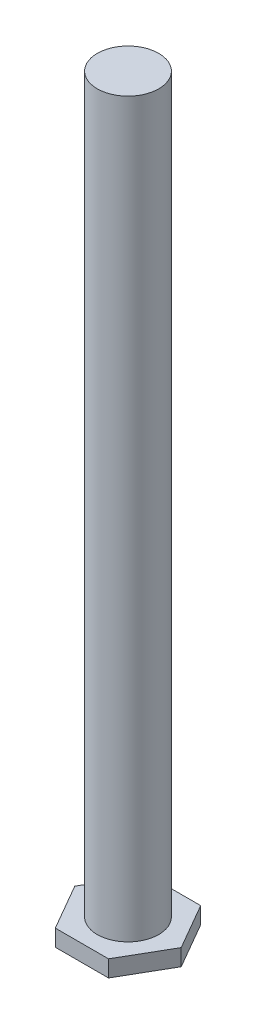
from build123d import *

# Parameters (mm, degrees)
BOSS_EXTRUDE1_DEPTH = 2.54
SKETCH2_R           = 4.699
BOSS_EXTRUDE2_DEPTH = 112.0394


with BuildPart() as part:
    # Sketch1 → Boss-Extrude1 (new body)
    with BuildSketch(Plane(origin=(0, 0, 0), x_dir=(1, 0, 0), z_dir=(0, 1, 0))):
        Polygon((-10.464308672, -1.215551007), (-14.533762044, 5.832948993), (-22.672668789, 5.832948993), (-26.742122161, -1.215551007), (-22.672668789, -8.264051007), (-14.533762044, -8.264051007), align=None)
    extrude(amount=BOSS_EXTRUDE1_DEPTH)


with BuildPart() as body_2:
    # Sketch2 → Boss-Extrude2 (new body)
    with BuildSketch(Plane(origin=(0, 2.54, 0), x_dir=(1, 0, 0), z_dir=(0, 1, 0))):
        with Locations(Location((-18.603215417, -1.215551007, 0), (0, 0, 270))):
            Circle(SKETCH2_R)
    extrude(amount=BOSS_EXTRUDE2_DEPTH)


solid = Compound([part.part, body_2.part])
